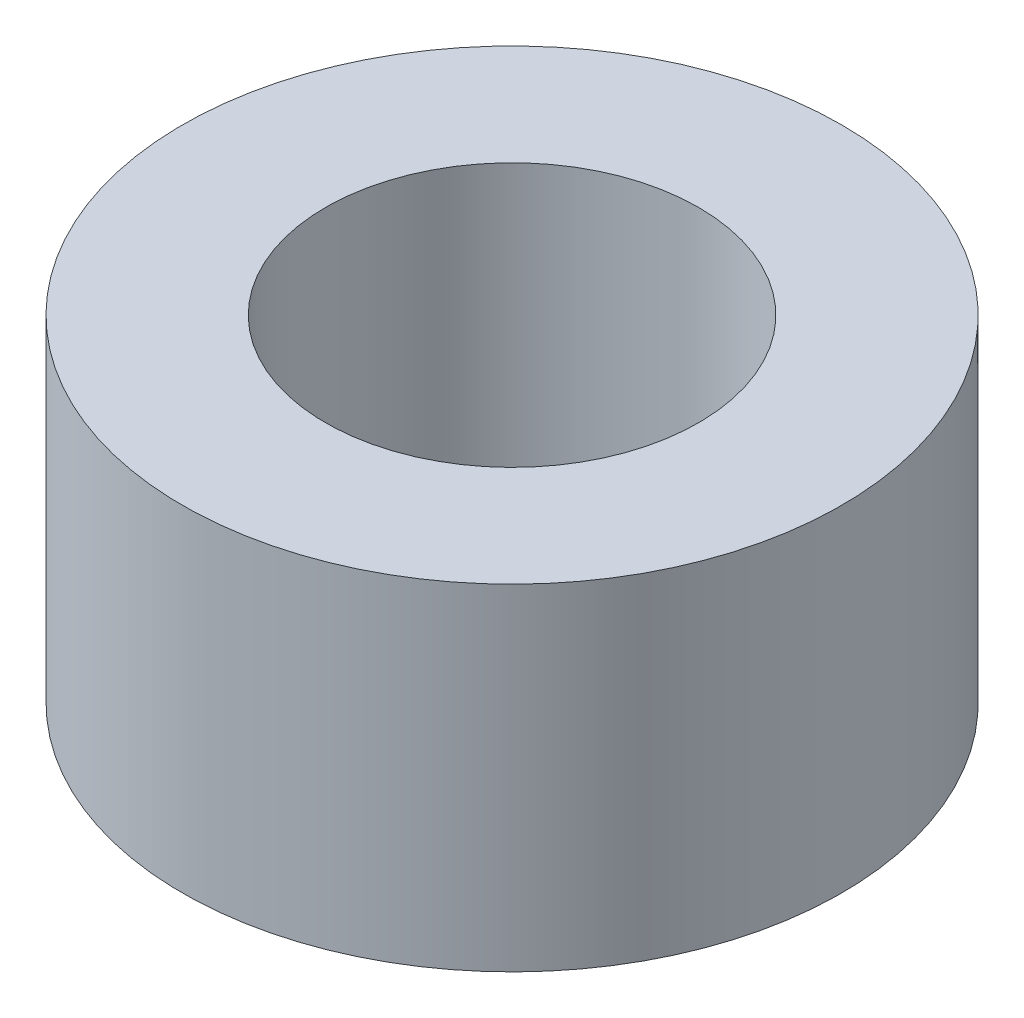
from build123d import *


with BuildPart() as part:
    # Sketch1 → Revolve1 (revolve)
    with BuildSketch(Plane(origin=(0, 0, 0), x_dir=(0, 0, -1), z_dir=(1, 0, 0))):
        Polygon((-19.05, -34.29), (-19.05, 0), (-33.655, 0), (-33.655, -24.619433914), (-33.655, -34.29), (-22.225, -34.29), align=None)
    revolve(axis=Axis((0, 0, 0), (0, 1, 0)))


solid = part.part
